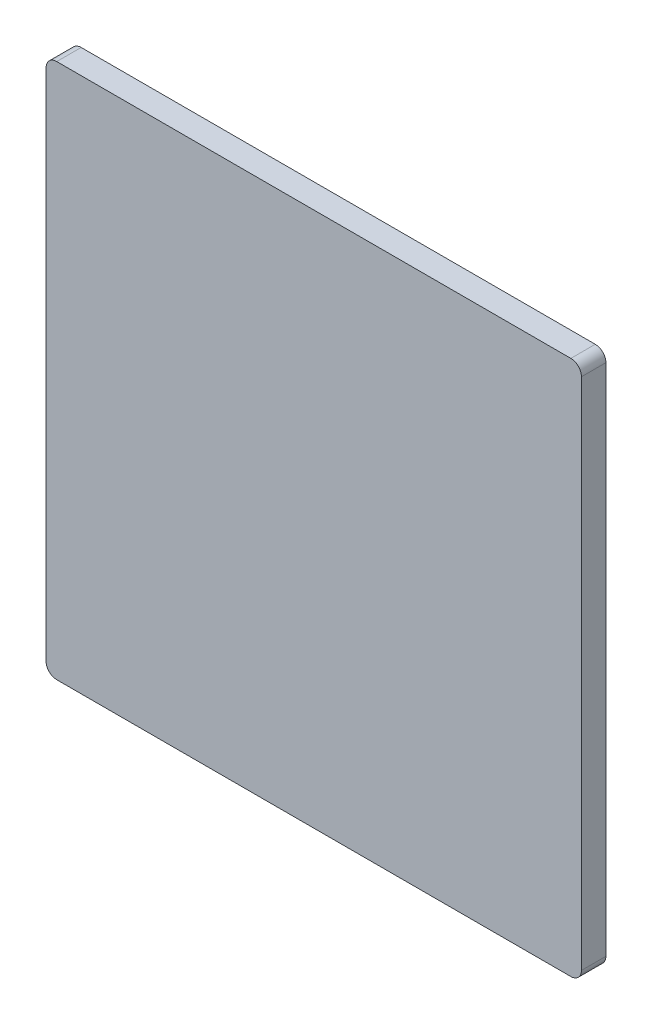
from build123d import *

# Parameters (mm, degrees)
SKETCH_1_W      = 25.2
SKETCH_1_H      = 25.2
EXTRUDE_1_DEPTH = 1.15
FILLET_1_R      = 0.5


with BuildPart() as part:
    # Эскиз1 → Бобышка-Вытянуть1 (new body)
    with BuildSketch(Plane.XY):
        Rectangle(SKETCH_1_W, SKETCH_1_H)
    extrude(amount=EXTRUDE_1_DEPTH)

    # Скругление1
    fillet_1_edges = [part.edges().sort_by_distance(p)[0] for p in [
        (12.6, -12.6, 0.575),
        (-12.6, -12.6, 0.575),
        (-12.6, 12.6, 0.575),
        (12.6, 12.6, 0.575),
    ]]
    fillet(fillet_1_edges, radius=FILLET_1_R)


solid = part.part
